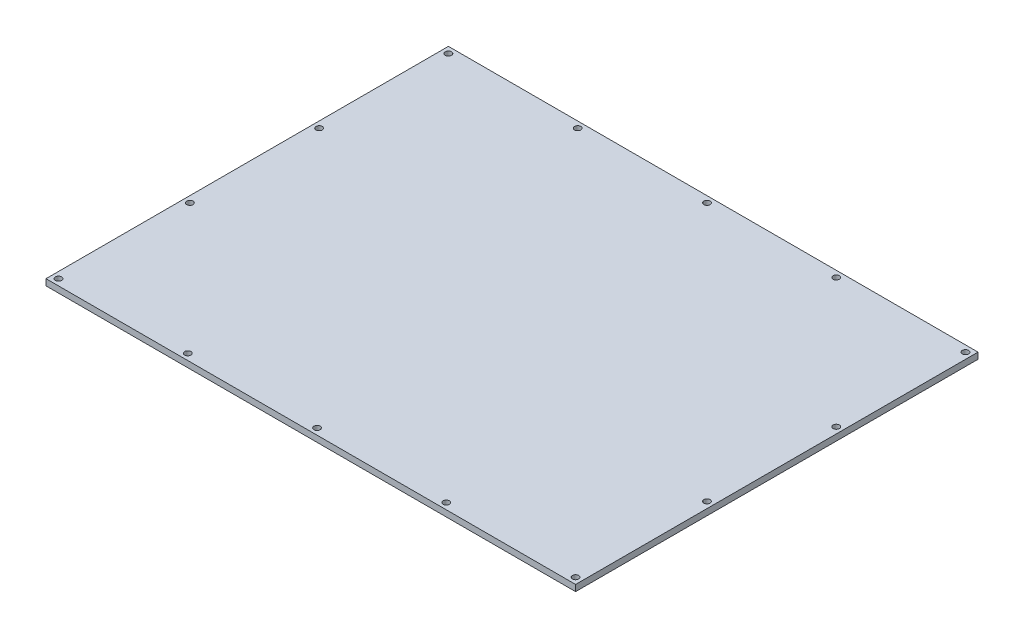
from build123d import *

# Parameters (mm, degrees)
SKETCH1_W            = 254
SKETCH1_H            = 193
BOSS_EXTRUDE1_DEPTH  = 3
CUT_EXTRUDE1_REACH   = 161.531
SKETCH2_R            = 1.5
LPATTERN1_COUNT      = 5
LPATTERN1_PITCH      = 62
LPATTERN1_COUNT_DIR2 = 2
LPATTERN1_PITCH_DIR2 = 187
LPATTERN2_COUNT      = 3
LPATTERN2_PITCH      = 62
LPATTERN2_COUNT_DIR2 = 2
LPATTERN2_PITCH_DIR2 = 248


with BuildPart() as part:
    # Sketch1 → Boss-Extrude1 (new body)
    with BuildSketch(Plane(origin=(0, 0, 0), x_dir=(1, 0, 0), z_dir=(0, 1, 0))):
        Rectangle(SKETCH1_W, SKETCH1_H)
    extrude(amount=BOSS_EXTRUDE1_DEPTH)

    # Sketch2 → Cut-Extrude1 (cut, up to next)
    with BuildSketch(Plane(origin=(0, 3, 0), x_dir=(1, 0, 0), z_dir=(0, 1, 0)), mode=Mode.PRIVATE) as cut_extrude1_sk1:
        with Locations(Location((-124, 93.5, 0), (0, 0, 270))):
            Circle(SKETCH2_R)
    cut_extrude1_tool1 = extrude(cut_extrude1_sk1.sketch, amount=-CUT_EXTRUDE1_REACH, mode=Mode.PRIVATE) & part.part
    cut_extrude1 = cut_extrude1_tool1.solids().sort_by_distance((-124, 3, -93.5))[0]
    add(cut_extrude1, mode=Mode.SUBTRACT)

    # LPattern1: Cut-Extrude1 5 × 2
    with Locations(*[(i * LPATTERN1_PITCH, 0, j * LPATTERN1_PITCH_DIR2) for i in range(LPATTERN1_COUNT) for j in range(LPATTERN1_COUNT_DIR2) if (i, j) != (0, 0)]):
        add(cut_extrude1, mode=Mode.SUBTRACT)

    # LPattern2: Cut-Extrude1 3 × 2
    with Locations(*[(j * LPATTERN2_PITCH_DIR2, 0, i * LPATTERN2_PITCH) for i in range(LPATTERN2_COUNT) for j in range(LPATTERN2_COUNT_DIR2) if (i, j) != (0, 0)]):
        add(cut_extrude1, mode=Mode.SUBTRACT)


solid = part.part
